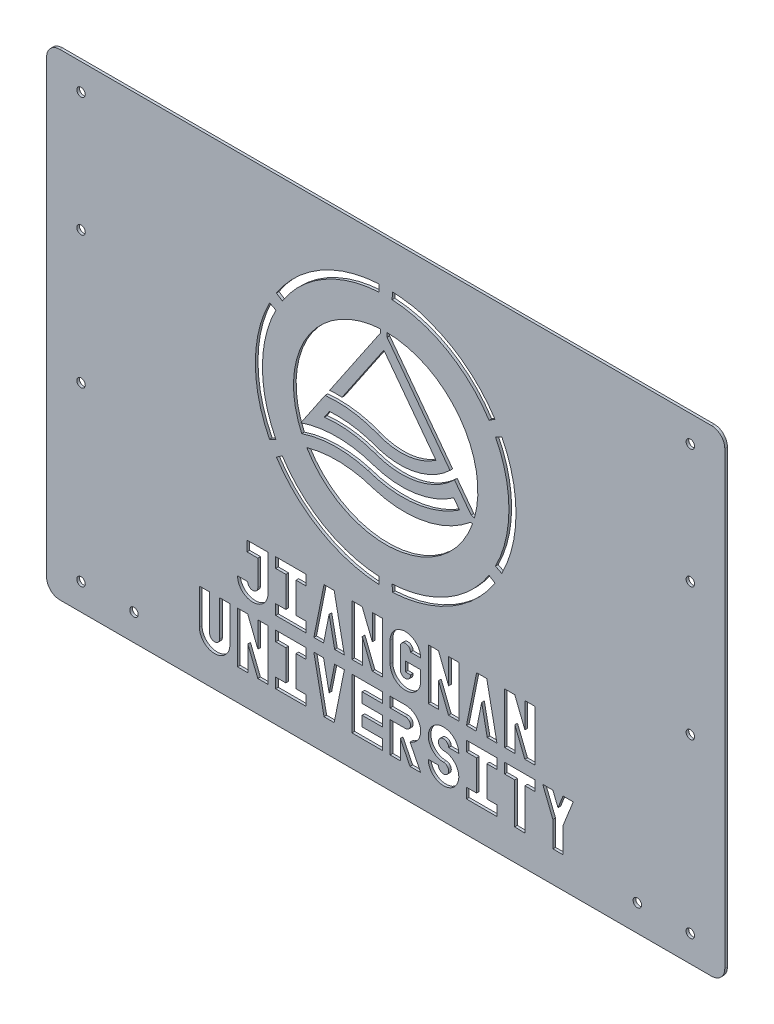
from build123d import *

# Parameters (mm, degrees)
MODEL_R             = 1.6
BOSS_EXTRUDE1_DEPTH = 1


with BuildPart() as part:
    # Model → Boss-Extrude1 (new body)
    with BuildSketch(Plane.XY):
        with BuildLine():
            Line((253.667153036, 182.538405254), (7.667153036, 182.538405254))
            ThreePointArc((7.667153036, 182.538405254), (4.13161913, 181.07393916), (2.667153036, 177.538405254))
            Line((2.667153036, 177.538405254), (2.667153036, 7.538405254))
            ThreePointArc((2.667153036, 7.538405254), (4.13161913, 4.002871348), (7.667153036, 2.538405254))
            Line((7.667153036, 2.538405254), (253.667153036, 2.538405254))
            ThreePointArc((253.667153036, 2.538405254), (257.202686942, 4.002871348), (258.667153036, 7.538405254))
            Line((258.667153036, 7.538405254), (258.667153036, 177.538405254))
            ThreePointArc((258.667153036, 177.538405254), (257.202686942, 181.07393916), (253.667153036, 182.538405254))
        make_face()
        with Locations((15.667153036, 12.538405254)):
            Circle(MODEL_R, mode=Mode.SUBTRACT)
        with Locations((35.667153036, 12.538405254)):
            Circle(MODEL_R, mode=Mode.SUBTRACT)
        with BuildLine():
            Line((68.027153036, 33.42111176), (71.867153036, 33.42111176))
            Line((71.867153036, 33.42111176), (71.867153036, 19.98111176))
            ThreePointArc((71.867153036, 19.98111176), (66.107153036, 14.22111176), (60.347153036, 19.98111176))
            Line((60.347153036, 19.98111176), (60.347153036, 33.42111176))
            Line((60.347153036, 33.42111176), (64.187153036, 33.42111176))
            Line((64.187153036, 33.42111176), (64.187153036, 19.98111176))
            ThreePointArc((64.187153036, 19.98111176), (66.107153036, 18.06111176), (68.027153036, 19.98111176))
            Line((68.027153036, 19.98111176), (68.027153036, 33.42111176))
        make_face(mode=Mode.SUBTRACT)
        Polygon((82.427153036, 33.42111176), (86.267153036, 33.42111176), (86.267153036, 14.22111176), (82.389834375, 14.22111176), (78.623569123, 23.636774891), (78.658613051, 14.22111176), (74.747153036, 14.22111176), (74.747153036, 33.42111176), (78.587153036, 33.42111176), (82.427153036, 23.82111176), align=None, mode=Mode.SUBTRACT)
        Polygon((89.147153036, 29.58111176), (89.147153036, 33.42111176), (100.667153036, 33.42111176), (100.667153036, 29.58111176), (96.827153036, 29.58111176), (96.827153036, 18.06111176), (100.667153036, 18.06111176), (100.667153036, 14.22111176), (89.147153036, 14.22111176), (89.147153036, 18.06111176), (92.987153036, 18.06111176), (92.987153036, 29.58111176), align=None, mode=Mode.SUBTRACT)
        Polygon((107.387153036, 14.22111176), (103.547153036, 33.42111176), (107.218447086, 33.42111176), (109.307153036, 22.977582009), (111.395858986, 33.42111176), (115.067153036, 33.42111176), (111.227153036, 14.22111176), align=None, mode=Mode.SUBTRACT)
        Polygon((117.947153036, 14.22111176), (117.947153036, 33.42111176), (121.787153036, 33.42111176), (129.467153036, 33.42111176), (129.467153036, 29.58111176), (121.787153036, 29.58111176), (121.787153036, 25.74111176), (129.467153036, 25.74111176), (129.467153036, 21.90111176), (121.787153036, 21.90111176), (121.787153036, 18.06111176), (129.467153036, 18.06111176), (129.467153036, 14.22111176), align=None, mode=Mode.SUBTRACT)
        with Locations((15.667153036, 77.538405254)):
            Circle(MODEL_R, mode=Mode.SUBTRACT)
        with BuildLine():
            Line((78.347153036, 53.58111176), (78.347153036, 57.42111176))
            Line((78.347153036, 57.42111176), (86.267153036, 57.42111176))
            Line((86.267153036, 57.42111176), (86.267153036, 43.98111176))
            ThreePointArc((86.267153036, 43.98111176), (80.507153036, 38.22111176), (74.747153036, 43.98111176))
            Line((74.747153036, 43.98111176), (78.587153036, 43.98111176))
            ThreePointArc((78.587153036, 43.98111176), (80.507153036, 42.06111176), (82.427153036, 43.98111176))
            Line((82.427153036, 43.98111176), (82.427153036, 53.58111176))
            Line((82.427153036, 53.58111176), (78.347153036, 53.58111176))
        make_face(mode=Mode.SUBTRACT)
        Polygon((89.147153036, 53.58111176), (89.147153036, 57.42111176), (100.667153036, 57.42111176), (100.667153036, 53.58111176), (96.827153036, 53.58111176), (96.827153036, 42.06111176), (100.667153036, 42.06111176), (100.667153036, 38.22111176), (89.147153036, 38.22111176), (89.147153036, 42.06111176), (92.987153036, 42.06111176), (92.987153036, 53.58111176), align=None, mode=Mode.SUBTRACT)
        Polygon((111.227153036, 57.42111176), (115.067153036, 38.22111176), (111.395858986, 38.22111176), (109.307153036, 48.664641511), (107.218447086, 38.22111176), (103.547153036, 38.22111176), (107.387153036, 57.42111176), align=None, mode=Mode.SUBTRACT)
        Polygon((125.627153036, 57.42111176), (129.467153036, 57.42111176), (129.467153036, 38.22111176), (125.589834375, 38.22111176), (121.823569123, 47.636774891), (121.858613051, 38.22111176), (117.947153036, 38.22111176), (117.947153036, 57.42111176), (121.787153036, 57.42111176), (125.627153036, 47.82111176), align=None, mode=Mode.SUBTRACT)
        with BuildLine():
            ThreePointArc((91.643316792, 91.593472569), (107.401858094, 76.63917525), (128.23193012, 70.469026815))
            Line((128.23193012, 70.469026815), (128.092223989, 67.803275032))
            ThreePointArc((128.092223989, 67.803275032), (106.067153036, 74.327398275), (89.404561093, 90.139607619))
            Line((89.404561093, 90.139607619), (91.643316792, 91.593472569))
        make_face(mode=Mode.SUBTRACT)
        with BuildLine():
            Line((132.347153036, 29.58111176), (132.347153036, 33.42111176))
            Line((132.347153036, 33.42111176), (138.107153036, 33.42111176))
            ThreePointArc((138.107153036, 33.42111176), (142.180088096, 31.73404682), (143.867153036, 27.66111176))
            ThreePointArc((143.867153036, 27.66111176), (142.766852959, 24.275141202), (139.886320875, 22.182776082))
            Line((139.886320875, 22.182776082), (143.867153036, 14.22111176))
            Line((143.867153036, 14.22111176), (139.842230677, 14.22111176))
            Line((139.842230677, 14.22111176), (136.187153036, 21.531267041))
            Line((136.187153036, 21.531267041), (136.187153036, 14.22111176))
            Line((136.187153036, 14.22111176), (132.347153036, 14.22111176))
            Line((132.347153036, 14.22111176), (132.347153036, 25.74111176))
            Line((132.347153036, 25.74111176), (138.107153036, 25.74111176))
            ThreePointArc((138.107153036, 25.74111176), (139.464798056, 26.30346674), (140.027153036, 27.66111176))
            ThreePointArc((140.027153036, 27.66111176), (139.464798056, 29.01875678), (138.107153036, 29.58111176))
            Line((138.107153036, 29.58111176), (132.347153036, 29.58111176))
        make_face(mode=Mode.SUBTRACT)
        with BuildLine():
            ThreePointArc((158.267153036, 19.98111176), (152.507153036, 14.22111176), (146.747153036, 19.98111176))
            Line((146.747153036, 19.98111176), (150.587153036, 19.98111176))
            ThreePointArc((150.587153036, 19.98111176), (152.507153036, 18.06111176), (154.427153036, 19.98111176))
            ThreePointArc((154.427153036, 19.98111176), (153.864798056, 21.33875678), (152.507153036, 21.90111176))
            ThreePointArc((152.507153036, 21.90111176), (148.434217976, 23.588176701), (146.747153036, 27.66111176))
            ThreePointArc((146.747153036, 27.66111176), (152.507153036, 33.42111176), (158.267153036, 27.66111176))
            Line((158.267153036, 27.66111176), (154.427153036, 27.66111176))
            ThreePointArc((154.427153036, 27.66111176), (152.507153036, 29.58111176), (150.587153036, 27.66111176))
            ThreePointArc((150.587153036, 27.66111176), (151.149508016, 26.30346674), (152.507153036, 25.74111176))
            ThreePointArc((152.507153036, 25.74111176), (156.580088096, 24.05404682), (158.267153036, 19.98111176))
        make_face(mode=Mode.SUBTRACT)
        Polygon((161.147153036, 29.58111176), (161.147153036, 33.42111176), (172.667153036, 33.42111176), (172.667153036, 29.58111176), (168.827153036, 29.58111176), (168.827153036, 18.06111176), (172.667153036, 18.06111176), (172.667153036, 14.22111176), (161.147153036, 14.22111176), (161.147153036, 18.06111176), (164.987153036, 18.06111176), (164.987153036, 29.58111176), align=None, mode=Mode.SUBTRACT)
        Polygon((175.547153036, 29.58111176), (175.547153036, 33.42111176), (187.067153036, 33.42111176), (187.067153036, 29.58111176), (183.227153036, 29.58111176), (183.227153036, 14.087599487), (179.387153036, 14.22111176), (179.387153036, 29.58111176), align=None, mode=Mode.SUBTRACT)
        with Locations((225.667153036, 12.538405254)):
            Circle(MODEL_R, mode=Mode.SUBTRACT)
        Polygon((193.822196965, 14.22111176), (193.787153036, 23.82111176), (189.947153036, 33.42111176), (193.787153036, 33.42111176), (195.707153036, 28.62111176), (197.627153036, 33.42111176), (201.467153036, 33.42111176), (197.627153036, 23.82111176), (197.592109107, 14.22111176), align=None, mode=Mode.SUBTRACT)
        with Locations((245.667153036, 12.538405254)):
            Circle(MODEL_R, mode=Mode.SUBTRACT)
        with BuildLine():
            Line((132.347153036, 43.98111176), (132.347153036, 51.66111176))
            ThreePointArc((132.347153036, 51.66111176), (138.107153036, 57.42111176), (143.867153036, 51.66111176))
            Line((143.867153036, 51.66111176), (140.027153036, 51.66111176))
            ThreePointArc((140.027153036, 51.66111176), (138.107153036, 53.58111176), (136.187153036, 51.66111176))
            Line((136.187153036, 51.66111176), (136.187153036, 43.98111176))
            ThreePointArc((136.187153036, 43.98111176), (138.107153036, 42.06111176), (140.027153036, 43.98111176))
            Line((140.027153036, 43.98111176), (140.027153036, 44.22111176))
            Line((140.027153036, 44.22111176), (138.107153036, 44.22111176))
            Line((138.107153036, 44.22111176), (138.107153036, 47.82111176))
            Line((138.107153036, 47.82111176), (143.867153036, 47.82111176))
            Line((143.867153036, 47.82111176), (143.867153036, 43.98111176))
            ThreePointArc((143.867153036, 43.98111176), (138.107153036, 38.22111176), (132.347153036, 43.98111176))
        make_face(mode=Mode.SUBTRACT)
        Polygon((154.427153036, 57.42111176), (158.267153036, 57.42111176), (158.267153036, 38.22111176), (154.389834375, 38.22111176), (150.623569123, 47.636774891), (150.658613051, 38.22111176), (146.747153036, 38.22111176), (146.747153036, 57.42111176), (150.587153036, 57.42111176), (154.427153036, 47.82111176), align=None, mode=Mode.SUBTRACT)
        Polygon((168.827153036, 57.42111176), (172.667153036, 38.22111176), (168.995858986, 38.22111176), (166.907153036, 48.664641511), (164.818447086, 38.22111176), (161.147153036, 38.22111176), (164.987153036, 57.42111176), align=None, mode=Mode.SUBTRACT)
        Polygon((183.227153036, 57.42111176), (187.067153036, 57.42111176), (187.067153036, 38.22111176), (183.189834375, 38.22111176), (179.423569123, 47.636774891), (179.458613051, 38.22111176), (175.547153036, 38.22111176), (175.547153036, 57.42111176), (179.387153036, 57.42111176), (183.227153036, 47.82111176), align=None, mode=Mode.SUBTRACT)
        with BuildLine():
            Line((133.242082083, 67.803275032), (133.102375952, 70.469026815))
            ThreePointArc((133.102375952, 70.469026815), (153.932447978, 76.63917525), (169.69098928, 91.593472569))
            Line((169.69098928, 91.593472569), (171.929744979, 90.139607619))
            ThreePointArc((171.929744979, 90.139607619), (155.267153036, 74.327398275), (133.242082083, 67.803275032))
        make_face(mode=Mode.SUBTRACT)
        with Locations((245.667153036, 77.538405254)):
            Circle(MODEL_R, mode=Mode.SUBTRACT)
        with Locations((15.667153036, 127.538405254)):
            Circle(MODEL_R, mode=Mode.SUBTRACT)
        with BuildLine():
            Line((86.829632046, 139.272180729), (89.208093876, 138.060293896))
            ThreePointArc((89.208093876, 138.060293896), (84.136563153, 116.935848142), (89.208093876, 95.811402387))
            Line((89.208093876, 95.811402387), (86.829632046, 94.599515554))
            ThreePointArc((86.829632046, 94.599515554), (81.467153036, 116.935848142), (86.829632046, 139.272180729))
        make_face(mode=Mode.SUBTRACT)
        with BuildLine():
            Line((128.788206136, 151.685086386), (128.788206136, 150.442700429))
            Line((128.788206136, 150.442700429), (109.531631139, 122.026258827))
            ThreePointArc((109.531631139, 122.026258827), (111.862400092, 122.105074966), (114.194092294, 122.061401433))
            Line((114.194092294, 122.061401433), (129.988206136, 145.368376517))
            Line((129.988206136, 145.368376517), (149.657853865, 119.186397132))
            ThreePointArc((149.657853865, 119.186397132), (139.174338817, 115.210523684), (128.04866213, 116.600119187))
            ThreePointArc((128.04866213, 116.600119187), (127.778595653, 116.706070841), (127.5098714, 116.815382008))
            ThreePointArc((127.5098714, 116.815382008), (117.816339384, 119.328728846), (107.803356839, 119.475888073))
            Line((107.803356839, 119.475888073), (98.626242308, 105.93345183))
            ThreePointArc((98.626242308, 105.93345183), (112.105785311, 108.186236975), (125.594991351, 105.992053561))
            ThreePointArc((125.594991351, 105.992053561), (125.789014485, 105.926221304), (125.982714164, 105.859443336))
            ThreePointArc((125.982714164, 105.859443336), (141.697987941, 104.442474794), (156.367087087, 110.255835266))
            Line((156.367087087, 110.255835266), (158.549331943, 107.35108117))
            ThreePointArc((158.549331943, 107.35108117), (142.888462776, 101.266488854), (126.120888084, 102.331160477))
            ThreePointArc((126.120888084, 102.331160477), (125.007953987, 102.669719689), (123.905606779, 103.04130451))
            ThreePointArc((123.905606779, 103.04130451), (111.402463186, 104.69881919), (98.970974634, 102.569489011))
            ThreePointArc((98.970974634, 102.569489011), (100.919754223, 134.994980564), (128.788206136, 151.685086386))
        make_face(mode=Mode.SUBTRACT)
        with Locations((15.667153036, 172.538405254)):
            Circle(MODEL_R, mode=Mode.SUBTRACT)
        with BuildLine():
            Line((128.092223989, 166.068421252), (128.23193012, 163.402669469))
            ThreePointArc((128.23193012, 163.402669469), (107.401858094, 157.232521034), (91.643316792, 142.278223714))
            Line((91.643316792, 142.278223714), (89.404561093, 143.732088664))
            ThreePointArc((89.404561093, 143.732088664), (106.067153036, 159.544298008), (128.092223989, 166.068421252))
        make_face(mode=Mode.SUBTRACT)
        with BuildLine():
            Line((162.748792585, 105.469331163), (163.456959054, 105.279578529))
            ThreePointArc((163.456959054, 105.279578529), (134.168203891, 82.312407485), (100.874557717, 98.951375279))
            ThreePointArc((100.874557717, 98.951375279), (112.807470704, 100.501900008), (124.690277016, 98.605204608))
            ThreePointArc((124.690277016, 98.605204608), (125.422022613, 98.369854193), (126.149338582, 98.121151727))
            ThreePointArc((126.149338582, 98.121151727), (145.384807124, 97.134545585), (162.748792585, 105.469331163))
        make_face(mode=Mode.SUBTRACT)
        with BuildLine():
            Line((107.543826897, 112.247772669), (109.446978215, 115.056205026))
            ThreePointArc((109.446978215, 115.056205026), (117.588399818, 114.7988671), (125.527037653, 112.974861108))
            ThreePointArc((125.527037653, 112.974861108), (126.616434833, 112.593532628), (127.694942291, 112.18241307))
            ThreePointArc((127.694942291, 112.18241307), (142.198164652, 111.605085218), (154.955803712, 118.52747006))
            Line((154.955803712, 118.52747006), (131.188206136, 150.164170338))
            Line((131.188206136, 150.164170338), (131.188206136, 151.731947114))
            ThreePointArc((131.188206136, 151.731947114), (158.546386992, 137.763433552), (164.18228741, 107.566975856))
            Line((164.18228741, 107.566975856), (162.939979126, 107.899851357))
            Line((162.939979126, 107.899851357), (156.648337395, 116.274563317))
            ThreePointArc((156.648337395, 116.274563317), (142.660007082, 108.765181864), (126.822497023, 109.877598105))
            ThreePointArc((126.822497023, 109.877598105), (126.756223278, 109.901997416), (126.690010015, 109.926560386))
            ThreePointArc((126.690010015, 109.926560386), (117.251959689, 112.201034567), (107.543826897, 112.247772669))
        make_face(mode=Mode.SUBTRACT)
        with BuildLine():
            ThreePointArc((172.126212196, 95.811402387), (177.197742919, 116.935848142), (172.126212196, 138.060293896))
            Line((172.126212196, 138.060293896), (174.504674026, 139.272180729))
            ThreePointArc((174.504674026, 139.272180729), (179.867153036, 116.935848142), (174.504674026, 94.599515554))
            Line((174.504674026, 94.599515554), (172.126212196, 95.811402387))
        make_face(mode=Mode.SUBTRACT)
        with Locations((245.667153036, 127.538405254)):
            Circle(MODEL_R, mode=Mode.SUBTRACT)
        with BuildLine():
            ThreePointArc((169.69098928, 142.278223714), (153.932447978, 157.232521034), (133.102375952, 163.402669469))
            Line((133.102375952, 163.402669469), (133.242082083, 166.068421252))
            ThreePointArc((133.242082083, 166.068421252), (135.955535181, 165.8508051), (138.652799219, 165.483448031))
            ThreePointArc((138.652799219, 165.483448031), (142.214170319, 164.896746787), (145.667321537, 163.846352039))
            ThreePointArc((145.667321537, 163.846352039), (146.602339916, 163.518020807), (147.525415735, 163.157477048))
            ThreePointArc((147.525415735, 163.157477048), (161.307728496, 155.429940357), (171.929744979, 143.732088664))
            Line((171.929744979, 143.732088664), (169.69098928, 142.278223714))
        make_face(mode=Mode.SUBTRACT)
        with Locations((245.667153036, 172.538405254)):
            Circle(MODEL_R, mode=Mode.SUBTRACT)
    extrude(amount=BOSS_EXTRUDE1_DEPTH)


solid = part.part
